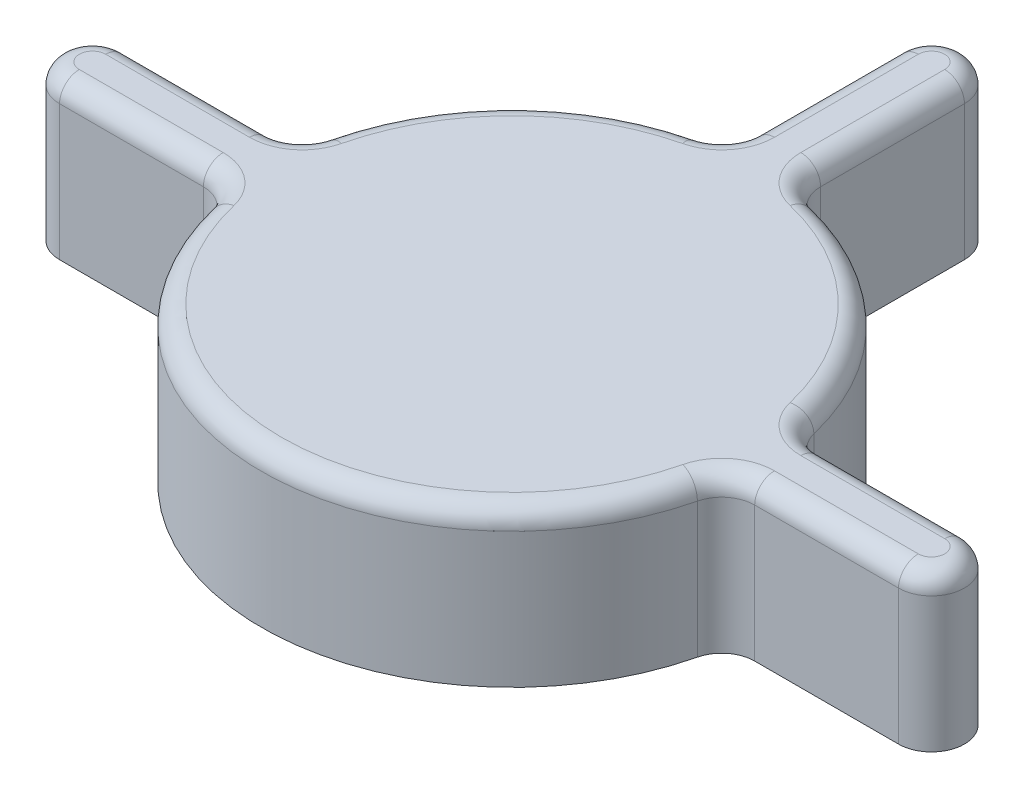
from build123d import *

# Parameters (mm, degrees)
BOSS_EXTRU_1_DEPTH      = 23.5
ESQUISSE2_W             = 20.710678119
ESQUISSE2_H             = 1.4
ESQUISSE2_W_2           = 1.4
ESQUISSE2_H_2           = 20.710678119
ENL_V_MAT_EXTRU_1_DEPTH = 15
ESQUISSE3_R             = 35
ENL_V_MAT_EXTRU_2_DEPTH = 20.5
CHANFREIN1_SIZE         = 4
CONG_1_R                = 3


with BuildPart() as part:
    # Esquisse1 → Boss.-Extru.1 (new body)
    with BuildSketch(Plane(origin=(0, 0, 0), x_dir=(1, 0, 0), z_dir=(0, 1, 0))):
        with BuildLine():
            Line((41.821047333, -5), (63.639610307, -5))
            ThreePointArc((63.639610307, -5), (68.639610307, 0), (63.639610307, 5))
            Line((63.639610307, 5), (41.821047333, 5))
            ThreePointArc((41.821047333, 5), (38.723786728, 6.074827807), (36.958134852, 8.837209302))
            ThreePointArc((36.958134852, 8.837209302), (26.870057685, 26.870057685), (8.837209302, 36.958134852))
            ThreePointArc((8.837209302, 36.958134852), (6.074827807, 38.723786728), (5, 41.821047333))
            Line((5, 41.821047333), (5, 63.639610307))
            ThreePointArc((5, 63.639610307), (0, 68.639610307), (-5, 63.639610307))
            Line((-5, 63.639610307), (-5, 41.821047333))
            ThreePointArc((-5, 41.821047333), (-6.074827807, 38.723786728), (-8.837209302, 36.958134852))
            ThreePointArc((-8.837209302, 36.958134852), (-26.870057685, 26.870057685), (-36.958134852, 8.837209302))
            ThreePointArc((-36.958134852, 8.837209302), (-38.723786728, 6.074827807), (-41.821047333, 5))
            Line((-41.821047333, 5), (-63.639610307, 5))
            ThreePointArc((-63.639610307, 5), (-68.639610307, 0), (-63.639610307, -5))
            Line((-63.639610307, -5), (-41.821047333, -5))
            ThreePointArc((-41.821047333, -5), (-38.723786728, -6.074827807), (-36.958134852, -8.837209302))
            ThreePointArc((-36.958134852, -8.837209302), (-30.152523014, -23.126291443), (-18.11627907, -33.403599097))
            ThreePointArc((-18.11627907, -33.403599097), (15.480011603, -34.704023409), (36.958134852, -8.837209302))
            ThreePointArc((36.958134852, -8.837209302), (38.723786728, -6.074827807), (41.821047333, -5))
        make_face()
    extrude(amount=-BOSS_EXTRU_1_DEPTH)

    # Esquisse2 → Enlèv. mat.-Extru.1 (cut)
    with BuildSketch(Plane.XZ.offset(23.5)):
        with Locations((55.35533906, 0)):
            Rectangle(ESQUISSE2_W, ESQUISSE2_H)
        with Locations((0, -55.35533906)):
            Rectangle(ESQUISSE2_W_2, ESQUISSE2_H_2)
        with Locations((-55.35533906, 0)):
            Rectangle(ESQUISSE2_W, ESQUISSE2_H)
    extrude(amount=-ENL_V_MAT_EXTRU_1_DEPTH, mode=Mode.SUBTRACT)

    # Esquisse3 → Enlèv. mat.-Extru.2 (cut)
    with BuildSketch(Plane.XZ.offset(23.5)):
        with Locations(Location((0, 0, 0), (0, 0, 270))):
            Circle(ESQUISSE3_R)
    extrude(amount=-ENL_V_MAT_EXTRU_2_DEPTH, mode=Mode.SUBTRACT)

    # Chanfrein1
    chanfrein1_edges = [part.edges().sort_by_distance(p)[0] for p in [
        (0, -3, 35),
    ]]
    chamfer(chanfrein1_edges, length=CHANFREIN1_SIZE)

    # Congé1
    cong_1_edges = [part.edges().sort_by_distance(p)[0] for p in [
        (68.639610307, 0, 0),
        (52.73032882, 0, -5),
        (38.723786728, 0, -6.074827807),
        (26.870057685, 0, -26.870057685),
        (6.074827807, 0, -38.723786728),
        (5, 0, -52.73032882),
        (0, 0, -68.639610307),
        (-5, 0, -52.73032882),
        (-6.074827807, 0, -38.723786728),
        (-26.870057685, 0, -26.870057685),
        (-38.723786728, 0, -6.074827807),
        (-52.73032882, 0, -5),
        (-68.639610307, 0, 0),
        (-52.73032882, 0, 5),
        (-38.723786728, 0, 6.074827807),
        (0, 0, 38),
        (38.723786728, 0, 6.074827807),
        (52.73032882, 0, 5),
    ]]
    fillet(cong_1_edges, radius=CONG_1_R)


solid = part.part
